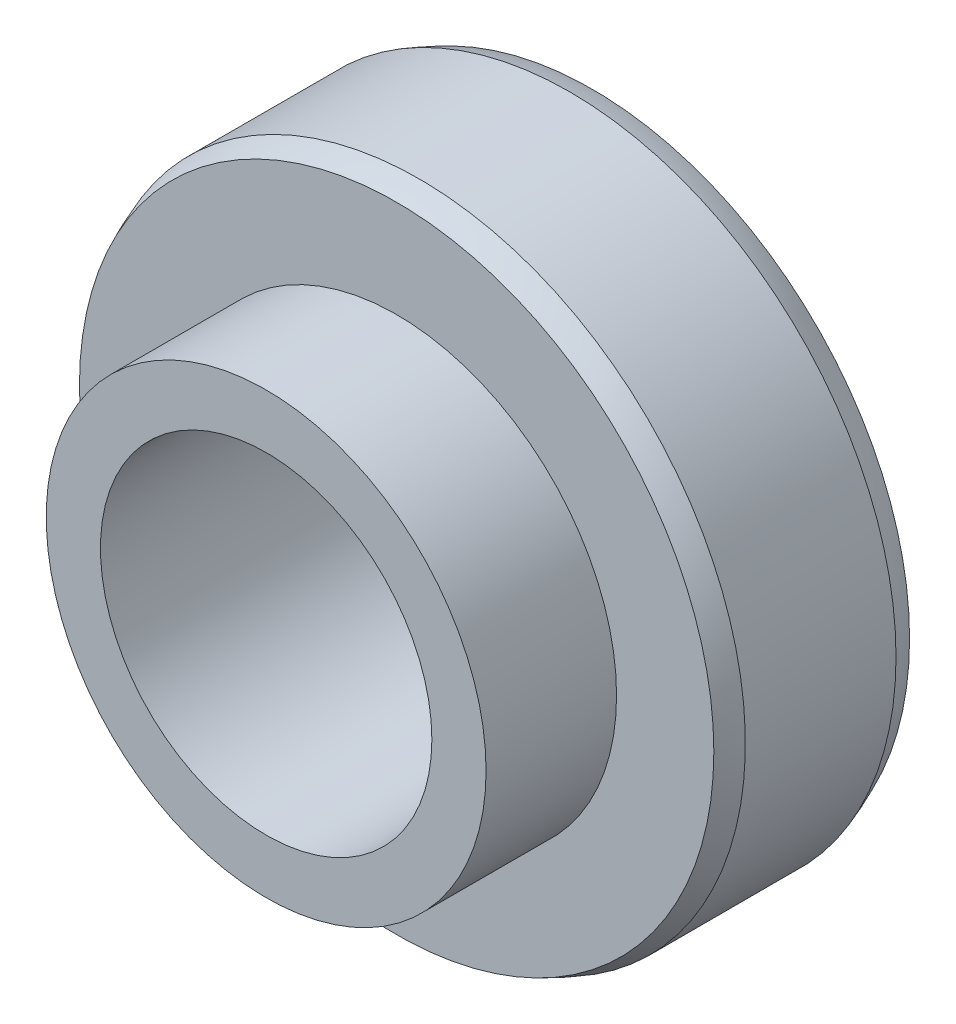
from build123d import *

# Parameters (mm, degrees)
SKETCH1_R           = 25
BOSS_EXTRUDE1_DEPTH = 15
SKETCH2_R           = 16.855
BOSS_EXTRUDE2_DEPTH = 10
SKETCH3_R           = 12.7
CUT_EXTRUDE1_DEPTH  = 30


with BuildPart() as part:
    # Sketch1 → Boss-Extrude1 (new body)
    with BuildSketch(Plane.XY):
        Circle(SKETCH1_R)
    extrude(amount=BOSS_EXTRUDE1_DEPTH)

    # Sketch2 → Boss-Extrude2 (add)
    with BuildSketch(Plane.XY.offset(15)):
        Circle(SKETCH2_R)
    extrude(amount=BOSS_EXTRUDE2_DEPTH)

    # Sketch3 → Cut-Extrude1 (cut)
    with BuildSketch(Plane.XY.offset(25)):
        Circle(SKETCH3_R)
    extrude(amount=-CUT_EXTRUDE1_DEPTH, mode=Mode.SUBTRACT)

    # Sketch8 → Cut-Revolve13 (revolve, cut)
    with BuildSketch(Plane(origin=(0, 0, 0), x_dir=(0, 0, -1), z_dir=(1, 0, 0)), mode=Mode.PRIVATE) as cut_revolve13_sk:
        with BuildLine():
            Line((-15, 26.011262748), (-15, 24.311262748))
            ThreePointArc((-15, 24.311262748), (-7.5, 25.954168843), (0, 24.311262748))
            Line((0, 24.311262748), (0, 26.011262748))
            Line((0, 26.011262748), (-15, 26.011262748))
        make_face()
    revolve(cut_revolve13_sk.sketch.rotate(Axis((0, 0, 0), (0, 0, 1)), 90), axis=Axis((0, 0, 0), (0, 0, 1)), mode=Mode.SUBTRACT)


solid = part.part
